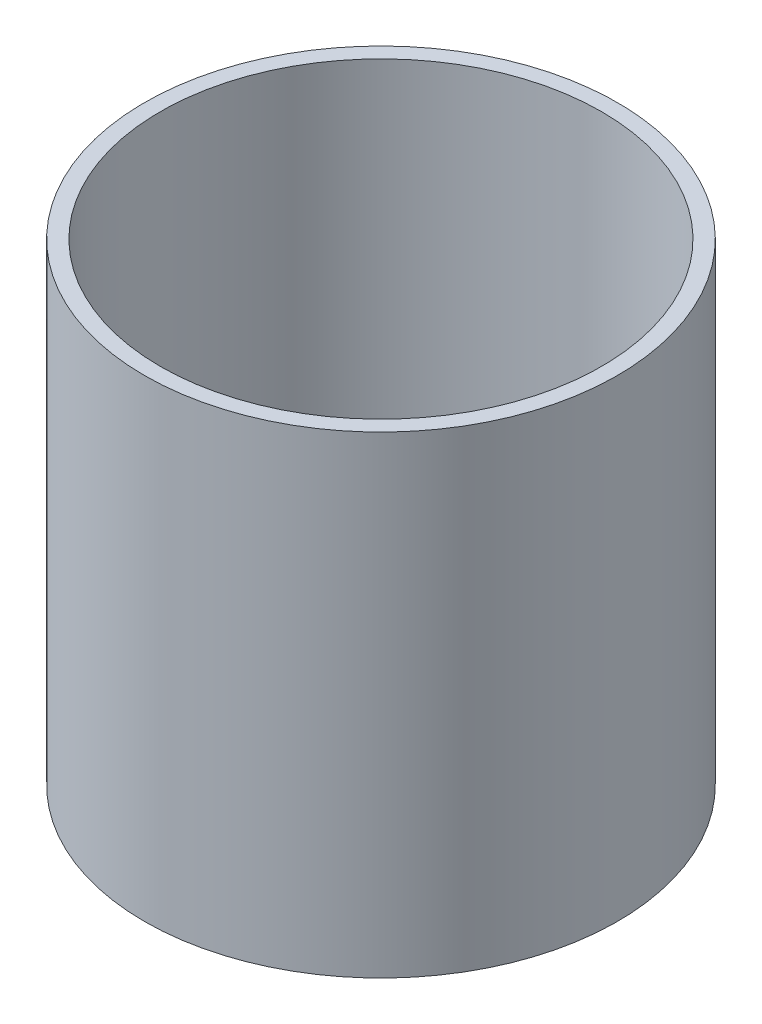
from build123d import *

# Parameters (mm, degrees)
SKETCH1_R               = 75
BOSS_EXTRUDE1_DEPTH     = 75
CUT_EXTRUDE1_DEPTH      = 130.903810568
CUT_EXTRUDE1_DEPTH_BACK = 95
SKETCH2_R               = 70
SKETCH3_R               = 7.5
CUT_EXTRUDE2_DEPTH      = 201.374649095


with BuildPart() as part:
    # Sketch1 → Boss-Extrude1 (new, symmetric)
    with BuildSketch(Plane(origin=(0, 0, 0), x_dir=(1, 0, 0), z_dir=(0, 1, 0))):
        with Locations(Location((0, 0, 0), (0, 0, 270))):
            Circle(SKETCH1_R)
    extrude(amount=BOSS_EXTRUDE1_DEPTH, both=True)

    # Sketch2 → Cut-Extrude1 (cut, two sides: drawn at the far end of the back side and taken through both)
    with BuildSketch(Plane(origin=(0, 0, 0), x_dir=(1, 0, 0), z_dir=(0, 1, 0)).offset(-CUT_EXTRUDE1_DEPTH_BACK)):
        with Locations(Location((0, 0, 0), (0, 0, 270))):
            Circle(SKETCH2_R)
    extrude(amount=CUT_EXTRUDE1_DEPTH + CUT_EXTRUDE1_DEPTH_BACK, mode=Mode.SUBTRACT)

    # Sketch3 → Cut-Extrude2 (cut, through all)
    with BuildSketch(Plane(origin=(0, -95, 0), x_dir=(1, 0, 0), z_dir=(0, 1, 0))):
        Circle(SKETCH3_R)
    extrude(amount=-CUT_EXTRUDE2_DEPTH, mode=Mode.SUBTRACT)


solid = part.part
